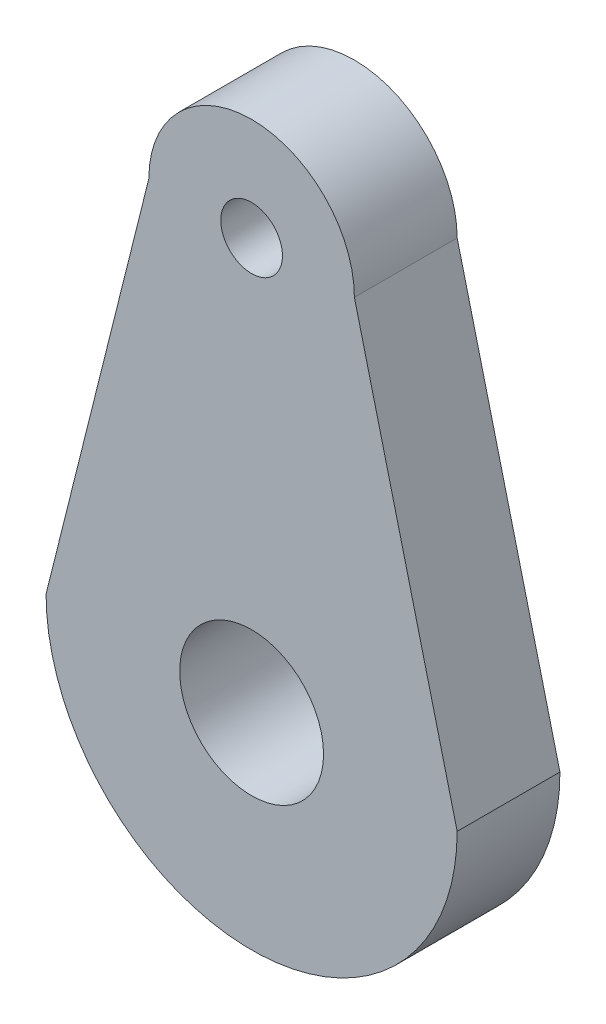
from build123d import *

# Parameters (mm, degrees)
SKETCH4_R           = 3.5
SKETCH4_R_2         = 1.5
BOSS_EXTRUDE2_DEPTH = 5


with BuildPart() as part:
    # Sketch4 → Boss-Extrude2 (new body)
    with BuildSketch(Plane.XY):
        with BuildLine():
            Line((5, 10), (10, -10))
            ThreePointArc((10, -10), (0, -20), (-10, -10))
            Line((-10, -10), (-5, 10))
            ThreePointArc((-5, 10), (0, 15), (5, 10))
        make_face()
        with Locations((0, -10)):
            Circle(SKETCH4_R, mode=Mode.SUBTRACT)
        with Locations((0, 10)):
            Circle(SKETCH4_R_2, mode=Mode.SUBTRACT)
    extrude(amount=BOSS_EXTRUDE2_DEPTH)


solid = part.part
